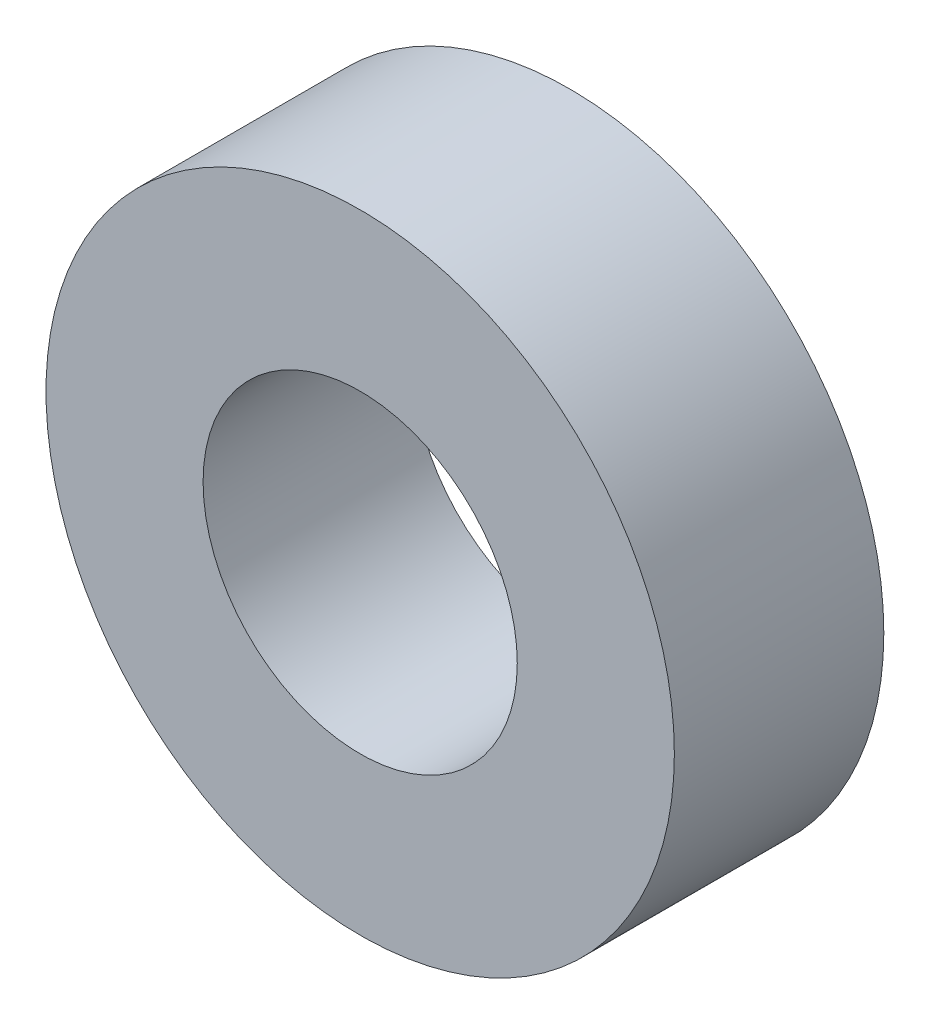
from build123d import *

# Parameters (mm, degrees)
SKETCH_1_W = 3
SKETCH_1_H = 4
SKETCH_1_R = 0.5


with BuildPart() as part:
    # Эскиз1 → Повернуть1 (revolve)
    with BuildSketch(Plane(origin=(0, 0, 0), x_dir=(1, 0, 0), z_dir=(0, 1, 0)), mode=Mode.PRIVATE) as revolve_1_sk:
        with Locations((-4.5, 2)):
            Rectangle(SKETCH_1_W, SKETCH_1_H)
        with Locations((-4.5, 2.5)):
            Circle(SKETCH_1_R, mode=Mode.SUBTRACT)
    revolve(revolve_1_sk.sketch.rotate(Axis((0, 0, 0), (0, 0, -1)), 180), axis=Axis((0, 0, 0), (0, 0, -1)))


solid = part.part
